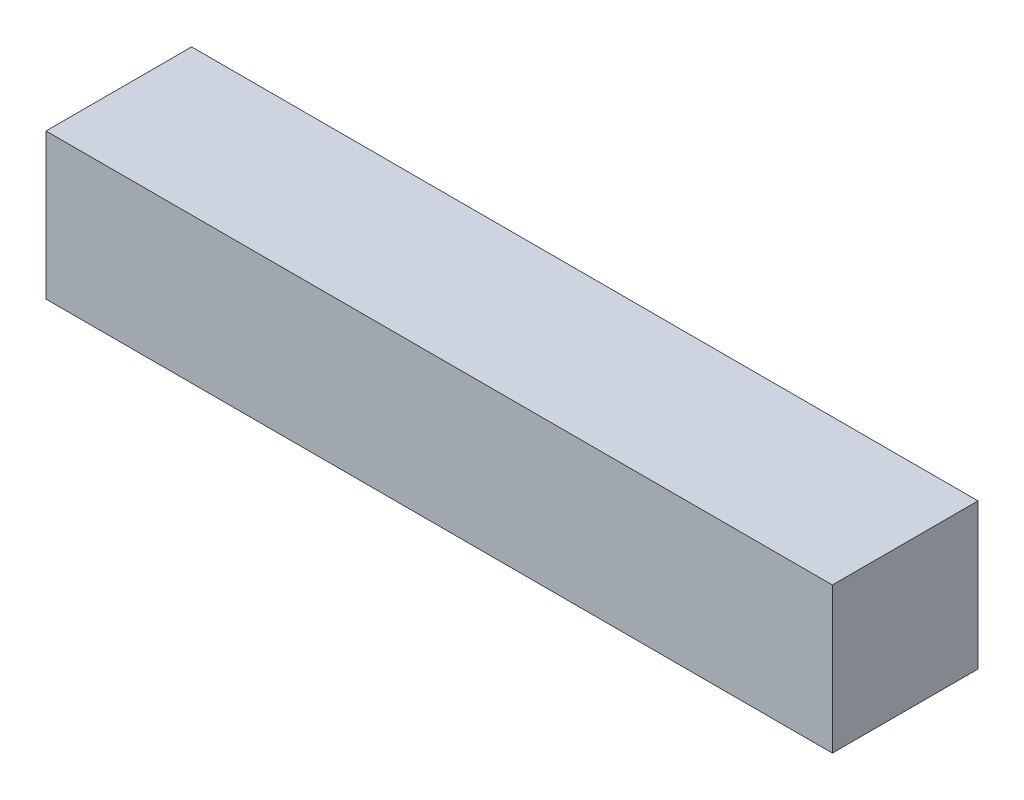
from build123d import *

# Parameters (mm, degrees)
SKETCH1_W           = 54
SKETCH1_H           = 10
BOSS_EXTRUDE1_DEPTH = 5


with BuildPart() as part:
    # Sketch1 → Boss-Extrude1 (new, symmetric)
    with BuildSketch(Plane.XY):
        Rectangle(SKETCH1_W, SKETCH1_H)
    extrude(amount=BOSS_EXTRUDE1_DEPTH, both=True)


solid = part.part
